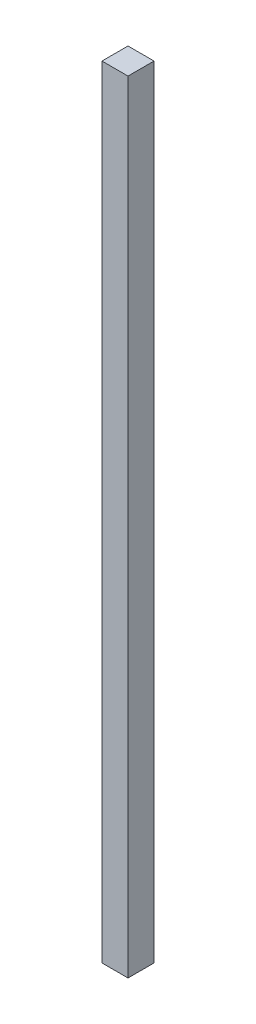
from build123d import *

# Parameters (mm, degrees)
SKETCH1_W           = 20
SKETCH1_H           = 20
BOSS_EXTRUDE1_DEPTH = 600


with BuildPart() as part:
    # Sketch1 → Boss-Extrude1 (new body)
    with BuildSketch(Plane(origin=(0, 0, 0), x_dir=(1, 0, 0), z_dir=(0, 1, 0))):
        Rectangle(SKETCH1_W, SKETCH1_H)
    extrude(amount=BOSS_EXTRUDE1_DEPTH)


solid = part.part
